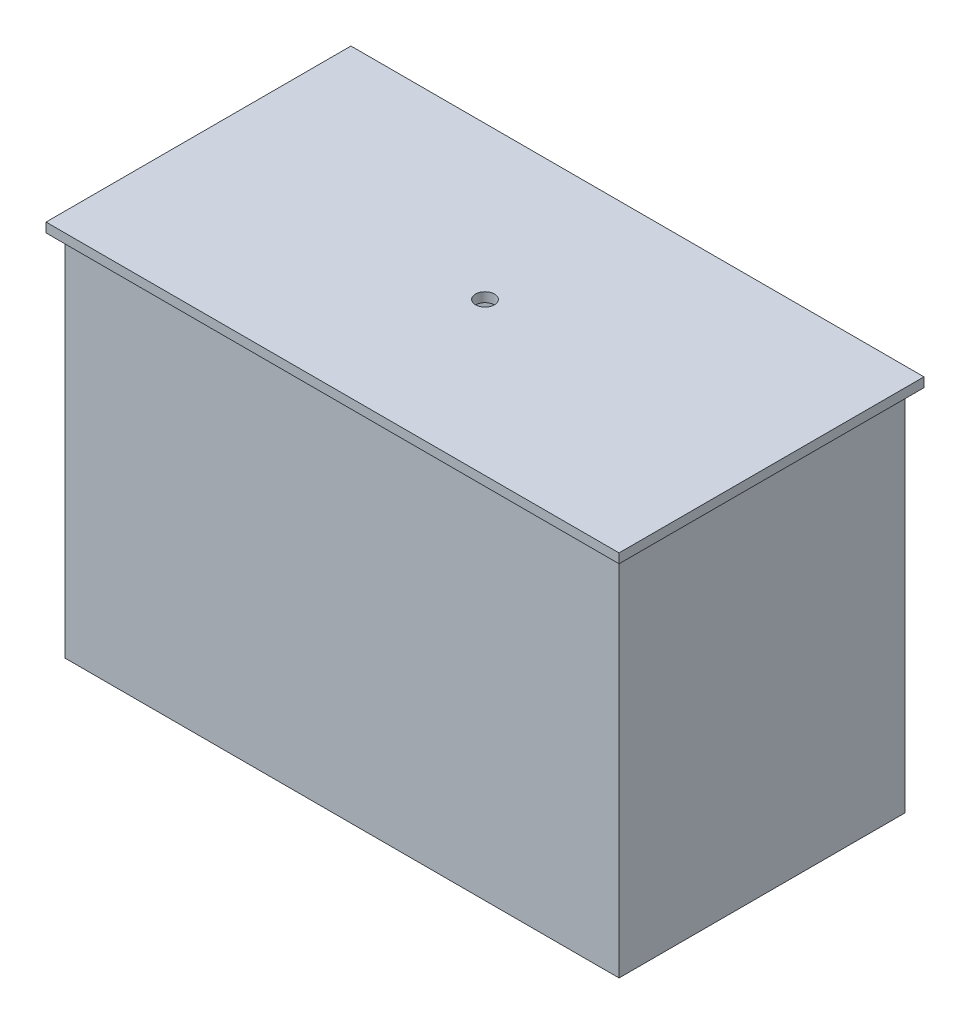
from build123d import *

# Parameters (mm, degrees)
SKETCH2_W      = 587
SKETCH2_H      = 303
BASE_DEPTH     = 10
SKETCH4_W      = 587
SKETCH4_H      = 303
SKETCH4_W_2    = 567
SKETCH4_H_2    = 283
WALLS_DEPTH    = 380
LID_DEPTH      = 10
LID_DEPTH_BACK = 597
SKETCH5_W      = 323
SKETCH5_H      = 10
INLET_REACH    = 529.441
SKETCH8_R      = 10
OUTLET_REACH   = 529.441
SKETCH9_R      = 10


with BuildPart() as part:
    # Sketch2 → Base (new body)
    with BuildSketch(Plane(origin=(0, 0, 0), x_dir=(1, 0, 0), z_dir=(0, 1, 0))):
        Rectangle(SKETCH2_W, SKETCH2_H)
    extrude(amount=BASE_DEPTH)

    # Sketch4 → Walls (add)
    with BuildSketch(Plane(origin=(0, 10, 0), x_dir=(1, 0, 0), z_dir=(0, 1, 0))):
        Rectangle(SKETCH4_W, SKETCH4_H)
        Rectangle(SKETCH4_W_2, SKETCH4_H_2, mode=Mode.SUBTRACT)
    extrude(amount=WALLS_DEPTH)

    # Sketch5 → Lid (add, two sides: drawn at the far end of the back side and taken through both)
    with BuildSketch(Plane.ZY.offset(293.5).offset(-LID_DEPTH_BACK)):
        with Locations((0, 395)):
            Rectangle(SKETCH5_W, SKETCH5_H)
    extrude(amount=LID_DEPTH + LID_DEPTH_BACK)

    # Sketch8 → Inlet (cut, up to next)
    with BuildSketch(Plane(origin=(0, 400, 0), x_dir=(1, 0, 0), z_dir=(0, 1, 0)), mode=Mode.PRIVATE) as inlet_sk1:
        with Locations(Location((0, 0, 0), (0, 0, 270))):
            Circle(SKETCH8_R)
    inlet_tool1 = extrude(inlet_sk1.sketch, amount=-INLET_REACH, mode=Mode.PRIVATE) & part.part
    add(inlet_tool1.solids().sort_by_distance((0, 400, 0))[0], mode=Mode.SUBTRACT)

    # Sketch9 → Outlet (cut, up to next)
    with BuildSketch(Plane.XZ, mode=Mode.PRIVATE) as outlet_sk1:
        with Locations(Location((-248.5, 0, 0), (0, 0, 270))):
            Circle(SKETCH9_R)
    outlet_tool1 = extrude(outlet_sk1.sketch, amount=-OUTLET_REACH, mode=Mode.PRIVATE) & part.part
    add(outlet_tool1.solids().sort_by_distance((-248.5, 0, 0))[0], mode=Mode.SUBTRACT)


solid = part.part
